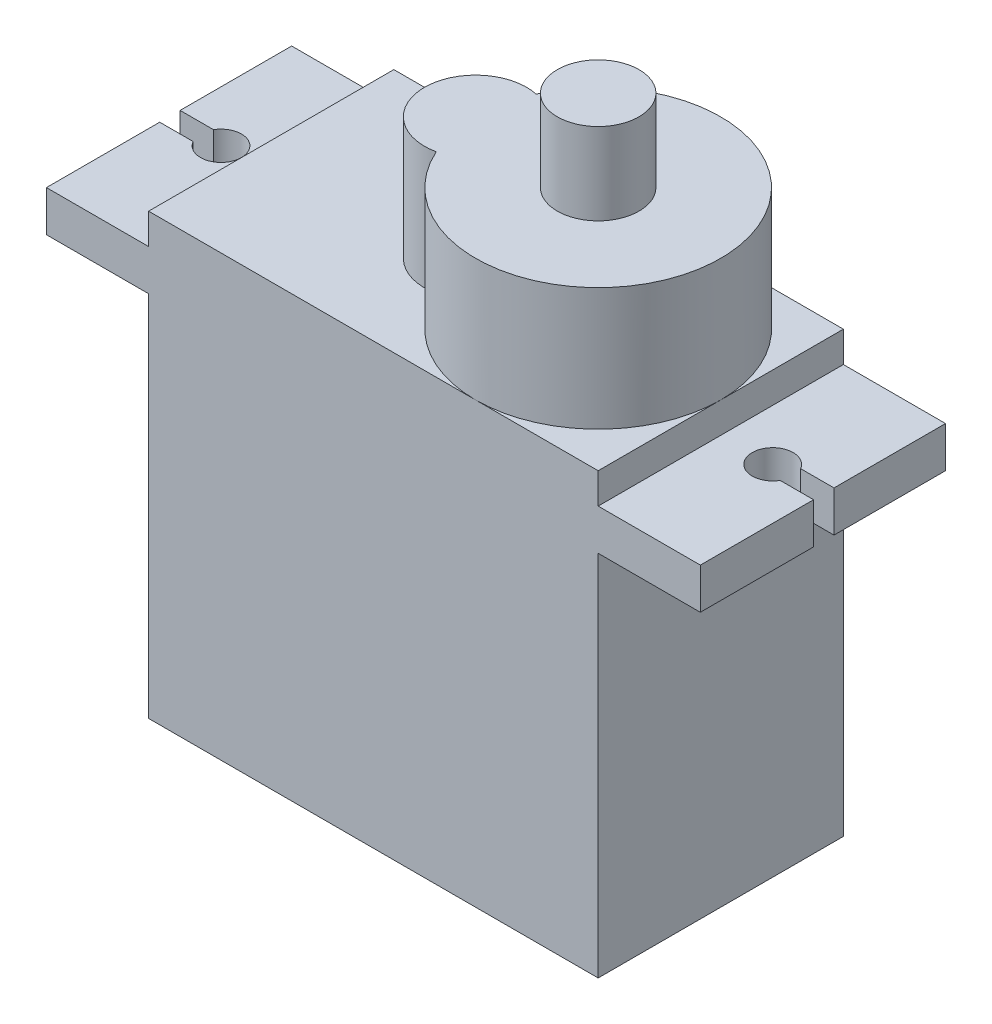
from build123d import *

# Parameters (mm, degrees)
EXTRUDE_1_DEPTH     = 12
EXTRUDE_3_DEPTH     = 6
SKETCH_4_R          = 2
EXTRUDE_4_DEPTH     = 4
CUT_EXTRUDE_2_DEPTH = 29.284271247


with BuildPart() as part:
    # 草图1 → 凸台-拉伸1 (new body)
    with BuildSketch(Plane.XY):
        Polygon((-11, 12.536842105), (-16, 12.536842105), (-16, 14.536842105), (-11, 14.536842105), (-11, 16.036842105), (11, 16.036842105), (11, 14.536842105), (16, 14.536842105), (16, 12.536842105), (11, 12.536842105), (11, -5.463157895), (-11, -5.463157895), align=None)
    extrude(amount=EXTRUDE_1_DEPTH)

    # 草图2 → 凸台-拉伸3 (add)
    with BuildSketch(Plane(origin=(0, 16.036842105, 0), x_dir=(1, 0, 0), z_dir=(0, 1, 0))):
        with BuildLine():
            ThreePointArc((-0.479166667, -8.445144707), (11, -6), (-0.479166667, -3.554855293))
            ThreePointArc((-0.479166667, -3.554855293), (-3.5, -6), (-0.479166667, -8.445144707))
        make_face()
    extrude(amount=EXTRUDE_3_DEPTH)

    # 草图4 → 凸台-拉伸4 (add)
    with BuildSketch(Plane(origin=(0, 22.036842105, 0), x_dir=(1, 0, 0), z_dir=(0, 1, 0))):
        with Locations(Location((5, -6, 0), (0, 0, 180))):
            Circle(SKETCH_4_R)
    extrude(amount=EXTRUDE_4_DEPTH)

    # 草图5 → 切除-拉伸2 (cut, through all)
    with BuildSketch(Plane(origin=(0, 14.536842105, 0), x_dir=(-1, 0, 0), z_dir=(0, -1, 0))):
        with BuildLine():
            Line((-14.366025404, -6.458256145), (-16, -6.458256145))
            Line((-16, -6.458256145), (-16, -5.458256145))
            Line((-16, -5.458256145), (-14.366025404, -5.458256145))
            ThreePointArc((-14.366025404, -5.458256145), (-12.5, -5.958256145), (-14.366025404, -6.458256145))
        make_face()
        with BuildLine():
            Line((16, -6.458256145), (16, -5.458256145))
            Line((16, -5.458256145), (14.366025404, -5.458256145))
            ThreePointArc((14.366025404, -5.458256145), (12.5, -5.958256145), (14.366025404, -6.458256145))
            Line((14.366025404, -6.458256145), (16, -6.458256145))
        make_face()
    extrude(amount=CUT_EXTRUDE_2_DEPTH, mode=Mode.SUBTRACT)


solid = part.part
